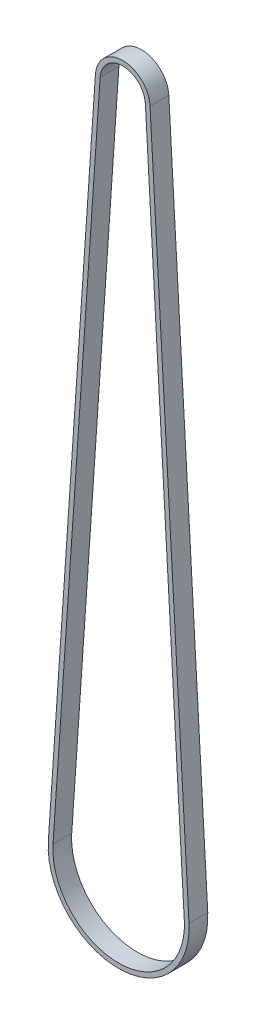
from build123d import *

# Parameters (mm, degrees)
EXTRUDE_1_DEPTH = 6


with BuildPart() as part:
    # 草图2 → 拉伸-薄壁1 (new body)
    with BuildSketch(Plane.XY):
        with BuildLine():
            Line((-23.812822564, -219.393789016), (-8.729505899, 0.598520476))
            ThreePointArc((-8.729505899, 0.598520476), (0.052103875, 8.749844866), (8.736014751, 0.494516198))
            Line((8.736014751, 0.494516198), (21.198319225, -219.661822899))
            ThreePointArc((21.198319225, -219.661822899), (-1.449917919, -243.485861984), (-23.812822564, -219.393789016))
        make_face()
        with BuildLine():
            Line((-22.316335838, -219.496392526), (-7.233019173, 0.495916966))
            ThreePointArc((-7.233019173, 0.495916966), (0.043171782, 7.249871461), (7.238412222, 0.409741992))
            Line((7.238412222, 0.409741992), (19.700716697, -219.746597104))
            ThreePointArc((19.700716697, -219.746597104), (-1.440985826, -241.985888579), (-22.316335838, -219.496392526))
        make_face(mode=Mode.SUBTRACT)
    extrude(amount=EXTRUDE_1_DEPTH)


solid = part.part
